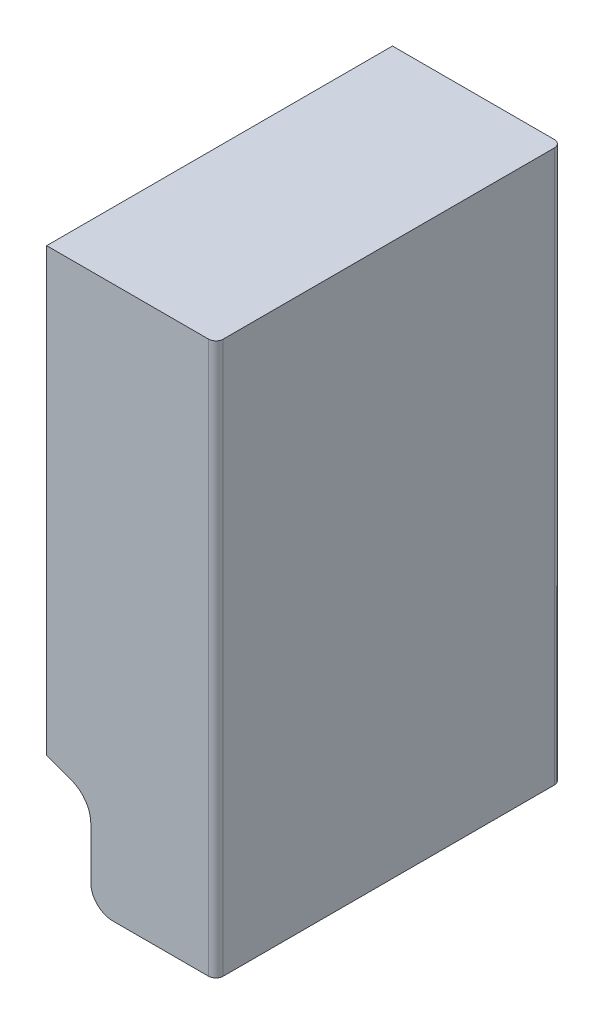
from build123d import *

# Parameters (mm, degrees)
SKETCH1_W           = 23
SKETCH1_H           = 47
BOSS_EXTRUDE1_DEPTH = 75
CUT_EXTRUDE1_REACH  = 91.254
FILLET1_R           = 3
FILLET2_R           = 1


with BuildPart() as part:
    # Sketch1 → Boss-Extrude1 (new body)
    with BuildSketch(Plane(origin=(0, 0, 0), x_dir=(1, 0, 0), z_dir=(0, 1, 0))):
        Rectangle(SKETCH1_W, SKETCH1_H)
    extrude(amount=-BOSS_EXTRUDE1_DEPTH)

    # Sketch2 → Cut-Extrude1 (cut, up to next)
    with BuildSketch(Plane.XY.offset(23.5), mode=Mode.PRIVATE) as cut_extrude1_sk1:
        with BuildLine():
            Line((-8.131919427, -61.241229517), (-11.5, -60.015348442))
            Line((-11.5, -60.015348442), (-11.5, -75))
            Line((-11.5, -75), (-5.5, -75))
            Line((-5.5, -75), (-5.5, -65))
            ThreePointArc((-5.5, -65), (-6.223391823, -62.705694255), (-8.131919427, -61.241229517))
        make_face()
    cut_extrude1_tool1 = extrude(cut_extrude1_sk1.sketch, amount=-CUT_EXTRUDE1_REACH, mode=Mode.PRIVATE) & part.part
    add(cut_extrude1_tool1.solids().sort_by_distance((-8.622504, -68.134359, 23.5))[0], mode=Mode.SUBTRACT)

    # Fillet1
    fillet1_edges = [part.edges().sort_by_distance(p)[0] for p in [
        (-5.5, -75, 0),
    ]]
    fillet(fillet1_edges, radius=FILLET1_R)

    # Fillet2
    fillet2_edges = [part.edges().sort_by_distance(p)[0] for p in [
        (11.5, -37.5, 23.5),
        (11.5, -37.5, -23.5),
    ]]
    fillet(fillet2_edges, radius=FILLET2_R)


solid = part.part
